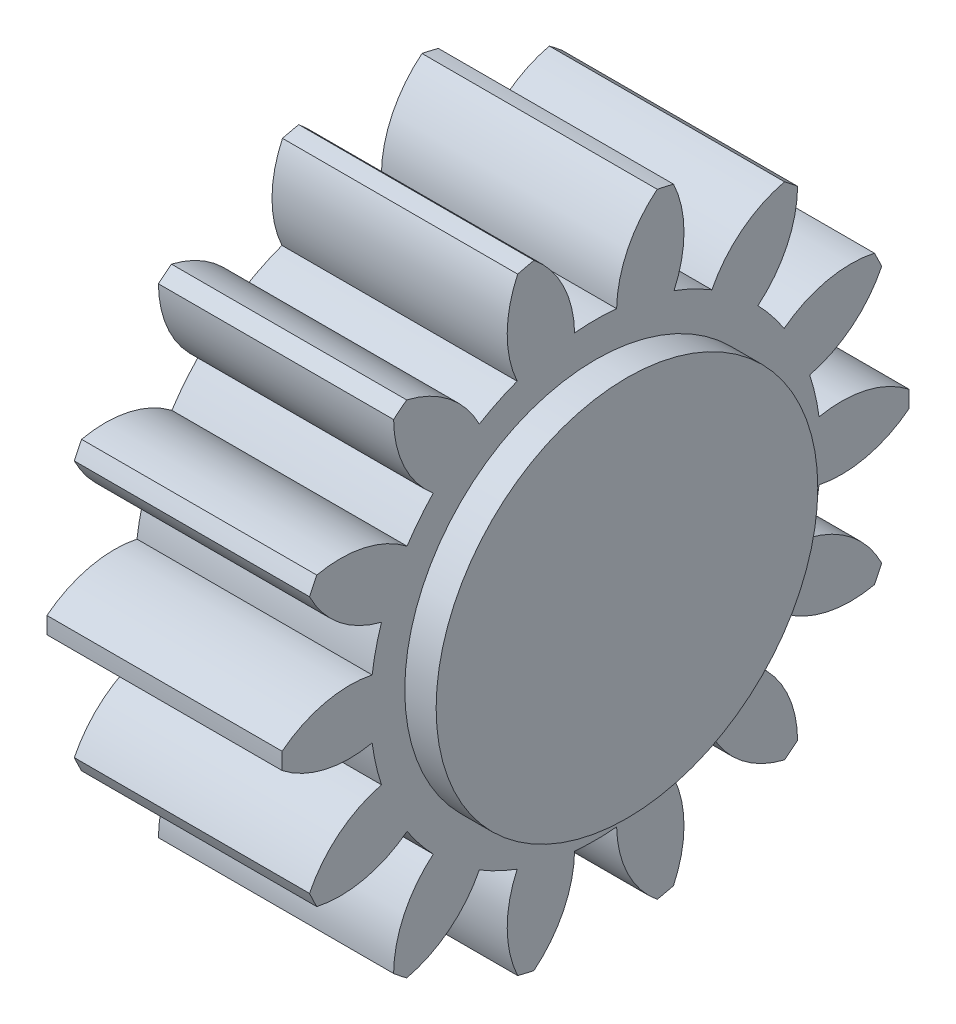
from build123d import *

# Parameters (mm, degrees)
BASPROSKE_W         = 15
BASPROSKE_H         = 20
TOOTHCUT_DEPTH      = 33.015621187
TEETHCUTS_COUNT     = 14
TEETHCUTS_ANGLE     = 334.285714286
BORSKE_R            = 2
BORE_DEPTH          = 50.0000508
SKETCH1_R           = 12.170076636
BOSS_EXTRUDE1_DEPTH = 2


with BuildPart() as part:
    # BasProSke → Base-Revolve (revolve)
    with BuildSketch(Plane(origin=(0, 0, 0), x_dir=(1, 0, 0), z_dir=(0, 1, 0)), mode=Mode.PRIVATE) as base_revolve_sk:
        with Locations((7.5, 10)):
            Rectangle(BASPROSKE_W, BASPROSKE_H)
    revolve(base_revolve_sk.sketch.rotate(Axis((-10, 0, 0), (1, 0, 0)), 180), axis=Axis((-10, 0, 0), (1, 0, 0)))

    # TooCutSke → ToothCut (cut, through all)
    with BuildSketch(Plane(origin=(0, 0, 0), x_dir=(0, 0, -1), z_dir=(1, 0, 0))):
        with BuildLine():
            ThreePointArc((1.339503949, 14.311450142), (0, 14.374), (-1.339503949, 14.311450142))
            ThreePointArc((-1.339503949, 14.311450142), (-2.055976555, 17.261705303), (-3.954182827, 19.631125371))
            ThreePointArc((-3.954182827, 19.631125371), (0, 20.0254), (3.954182827, 19.631125371))
            ThreePointArc((3.954182827, 19.631125371), (2.055976555, 17.261705303), (1.339503949, 14.311450142))
        make_face()
    toothcut = extrude(amount=TOOTHCUT_DEPTH, mode=Mode.SUBTRACT)

    # TeethCuts: ToothCut ×14 about axis
    teethcuts_axis = Axis((-10, 0, 0), (1, 0, 0))
    for i in range(1, TEETHCUTS_COUNT):
        add(toothcut.rotate(teethcuts_axis, i * TEETHCUTS_ANGLE / (TEETHCUTS_COUNT - 1)), mode=Mode.SUBTRACT)

    # BorSke → Bore (cut, symmetric)
    with BuildSketch(Plane(origin=(0, 0, 0), x_dir=(0, 0, -1), z_dir=(1, 0, 0))):
        with Locations(Location((0, 0, 0), (0, 0, 180))):
            Circle(BORSKE_R)
    extrude(amount=BORE_DEPTH, both=True, mode=Mode.SUBTRACT)

    # Sketch1 → Boss-Extrude1 (add)
    with BuildSketch(Plane(origin=(15, 0, 0), x_dir=(0, 0, -1), z_dir=(1, 0, 0))):
        with Locations(Location((0, 0, 0), (0, 0, 180))):
            Circle(SKETCH1_R)
    extrude(amount=BOSS_EXTRUDE1_DEPTH)


solid = part.part
